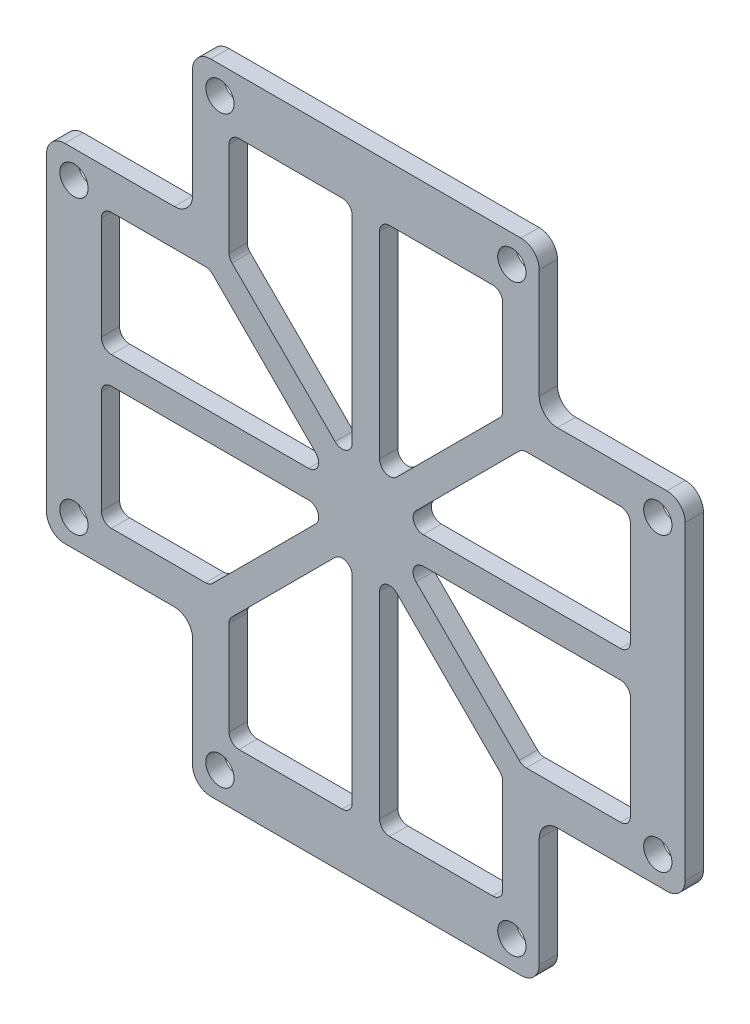
from build123d import *

# Parameters (mm, degrees)
SKETCH_1_W          = 16
SKETCH_1_H          = 38
SKETCH_1_R          = 1.55
SKETCH_1_W_2        = 38
SKETCH_1_H_2        = 16
EXTRUDE_1_DEPTH     = 2
FILLET_1_R          = 2
SKETCH_2_W          = 14
SKETCH_2_H          = 30
SKETCH_2_W_2        = 30
SKETCH_2_H_2        = 14
CUT_EXTRUDE_1_DEPTH = 2
EXTRUDE_2_DEPTH     = 2
FILLET_2_R          = 1.1


with BuildPart() as part:
    # 草图1 → 凸台-拉伸1 (new body)
    # profile 1 of 5: a face of its own
    with BuildSketch(Plane.XY):
        with Locations((-27, 0)):
            Rectangle(SKETCH_1_W, SKETCH_1_H)
        with Locations((-32, -16)):
            Circle(SKETCH_1_R, mode=Mode.SUBTRACT)
        with Locations((-32, 16)):
            Circle(SKETCH_1_R, mode=Mode.SUBTRACT)
    # profile 2 of 5: a face of its own
    with BuildSketch(Plane.XY):
        Rectangle(SKETCH_1_W_2, SKETCH_1_H)
    # profile 3 of 5: a face of its own
    with BuildSketch(Plane.XY):
        with Locations((0, 27)):
            Rectangle(SKETCH_1_W_2, SKETCH_1_H_2)
        with Locations((-16, 32)):
            Circle(SKETCH_1_R, mode=Mode.SUBTRACT)
        with Locations((16, 32)):
            Circle(SKETCH_1_R, mode=Mode.SUBTRACT)
    # profile 4 of 5: a face of its own
    with BuildSketch(Plane.XY):
        with Locations((27, 0)):
            Rectangle(SKETCH_1_W, SKETCH_1_H)
        with Locations((32, -16)):
            Circle(SKETCH_1_R, mode=Mode.SUBTRACT)
        with Locations((32, 16)):
            Circle(SKETCH_1_R, mode=Mode.SUBTRACT)
    # profile 5 of 5: a face of its own
    with BuildSketch(Plane.XY):
        with Locations((0, -27)):
            Rectangle(SKETCH_1_W_2, SKETCH_1_H_2)
        with Locations((-16, -32)):
            Circle(SKETCH_1_R, mode=Mode.SUBTRACT)
        with Locations((16, -32)):
            Circle(SKETCH_1_R, mode=Mode.SUBTRACT)
    extrude(amount=EXTRUDE_1_DEPTH)

    # 圆角1
    fillet_1_edges = [part.edges().sort_by_distance(p)[0] for p in [
        (-19, 19, 1),
        (-19, 35, 1),
        (19, 35, 1),
        (19, 19, 1),
        (35, 19, 1),
        (35, -19, 1),
        (19, -19, 1),
        (19, -35, 1),
        (-19, -35, 1),
        (-19, -19, 1),
        (-35, -19, 1),
        (-35, 19, 1),
    ]]
    fillet(fillet_1_edges, radius=FILLET_1_R)

    # 草图2 → 切除-拉伸1 (cut)
    with BuildSketch(Plane.XY.offset(2)):
        with Locations((-22, 0)):
            Rectangle(SKETCH_2_W, SKETCH_2_H)
        with Locations((22, 0)):
            Rectangle(SKETCH_2_W, SKETCH_2_H)
        Rectangle(SKETCH_2_W_2, SKETCH_2_H)
        with Locations((0, -22)):
            Rectangle(SKETCH_2_W_2, SKETCH_2_H_2)
        with Locations((0, 22)):
            Rectangle(SKETCH_2_W_2, SKETCH_2_H_2)
    extrude(amount=-CUT_EXTRUDE_1_DEPTH, mode=Mode.SUBTRACT)

    # 草图3 → 凸台-拉伸2 (add)
    with BuildSketch(Plane.XY.offset(2)):
        Polygon((-17.121320344, 15), (-3.621320344, 1.5), (-29, 1.5), (-29, -1.5), (-3.621320344, -1.5), (-17.121320344, -15), (-15, -17.121320344), (-1.5, -3.621320344), (-1.5, -29), (1.5, -29), (1.5, -3.621320344), (13.939339828, -16.060660172), (15, -17.121320344), (17.121320344, -15), (16.060660172, -13.939339828), (3.621320344, -1.5), (29, -1.5), (29, 1.5), (3.621320344, 1.5), (17.121320344, 15), (15, 17.121320344), (1.5, 3.621320344), (1.5, 29), (-1.5, 29), (-1.5, 3.621320344), (-15, 17.121320344), align=None)
    extrude(amount=-EXTRUDE_2_DEPTH)

    # 圆角2
    fillet_2_edges = [part.edges().sort_by_distance(p)[0] for p in [
        (-29, -15, 1),
        (-29, 15, 1),
        (-15, 29, 1),
        (15, 29, 1),
        (29, 15, 1),
        (29, -15, 1),
        (15, -29, 1),
        (-15, -29, 1),
        (-17.121320344, 15, 1),
        (-15, 17.121320344, 1),
        (-1.5, 3.621320344, 1),
        (-1.5, 29, 1),
        (1.5, 29, 1),
        (1.5, 3.621320344, 1),
        (15, 17.121320344, 1),
        (17.121320344, 15, 1),
        (3.621320344, 1.5, 1),
        (29, 1.5, 1),
        (29, -1.5, 1),
        (3.621320344, -1.5, 1),
        (17.121320344, -15, 1),
        (15, -17.121320344, 1),
        (1.5, -3.621320344, 1),
        (1.5, -29, 1),
        (-1.5, -29, 1),
        (-1.5, -3.621320344, 1),
        (-15, -17.121320344, 1),
        (-17.121320344, -15, 1),
        (-3.621320344, -1.5, 1),
        (-29, -1.5, 1),
        (-29, 1.5, 1),
        (-3.621320344, 1.5, 1),
    ]]
    fillet(fillet_2_edges, radius=FILLET_2_R)


solid = part.part
